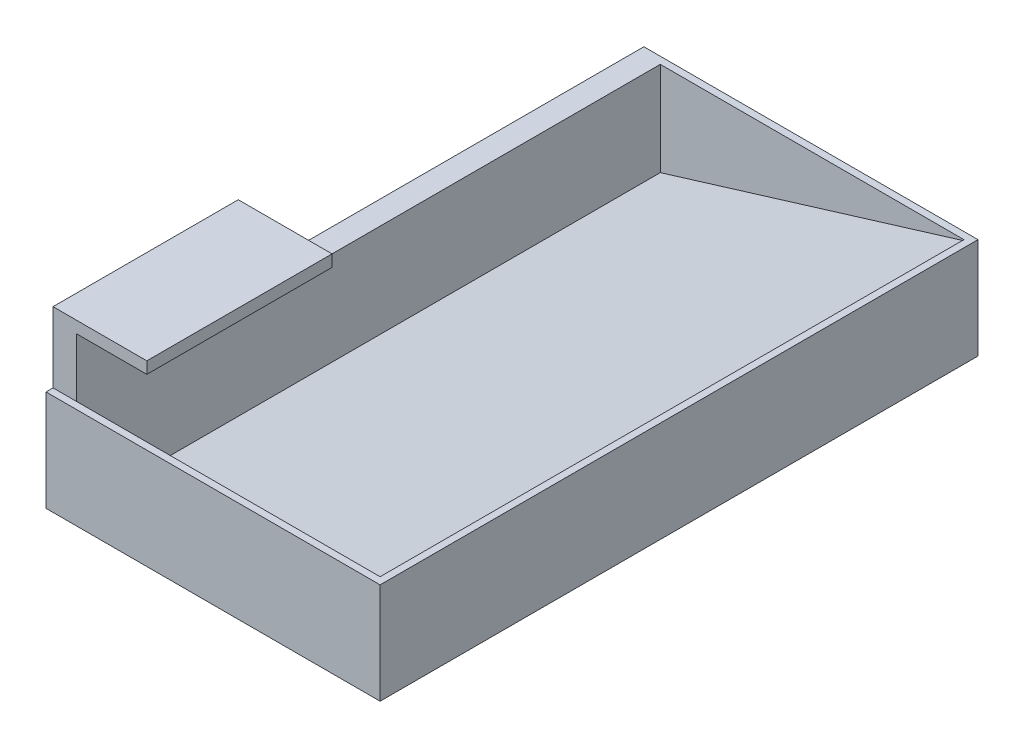
from build123d import *

# Parameters (mm, degrees)
SKETCH1_W           = 142.5
SKETCH1_H           = 255
BOSS_EXTRUDE1_DEPTH = 43
SKETCH2_W           = 129.5
SKETCH2_H           = 249
CUT_EXTRUDE1_DEPTH  = 40
BOSS_EXTRUDE2_DEPTH = 79
BOSS_EXTRUDE3_DEPTH = 250


with BuildPart() as part:
    # Sketch1 → Boss-Extrude1 (new body)
    with BuildSketch(Plane(origin=(0, 0, 0), x_dir=(1, 0, 0), z_dir=(0, 1, 0))):
        with Locations((71.25, 127.5)):
            Rectangle(SKETCH1_W, SKETCH1_H)
    extrude(amount=BOSS_EXTRUDE1_DEPTH)

    # Sketch2 → Cut-Extrude1 (cut)
    with BuildSketch(Plane(origin=(0, 43, 0), x_dir=(1, 0, 0), z_dir=(0, 1, 0))):
        with Locations((74.75, 127.5)):
            Rectangle(SKETCH2_W, SKETCH2_H)
    extrude(amount=-CUT_EXTRUDE1_DEPTH, mode=Mode.SUBTRACT)

    # Sketch5 → Boss-Extrude2 (add)
    with BuildSketch(Plane.XY.offset(-3)):
        Polygon((10, 43), (10, 68), (40, 68), (40, 73), (0, 73), (0, 43), align=None)
    extrude(amount=-BOSS_EXTRUDE2_DEPTH)

    # Sketch6 → Boss-Extrude3 (add)
    with BuildSketch(Plane.XY.offset(-3)):
        Polygon((10, 3), (139.5, 42.592123249), (139.5, 3), align=None)
    extrude(amount=-BOSS_EXTRUDE3_DEPTH)


solid = part.part
